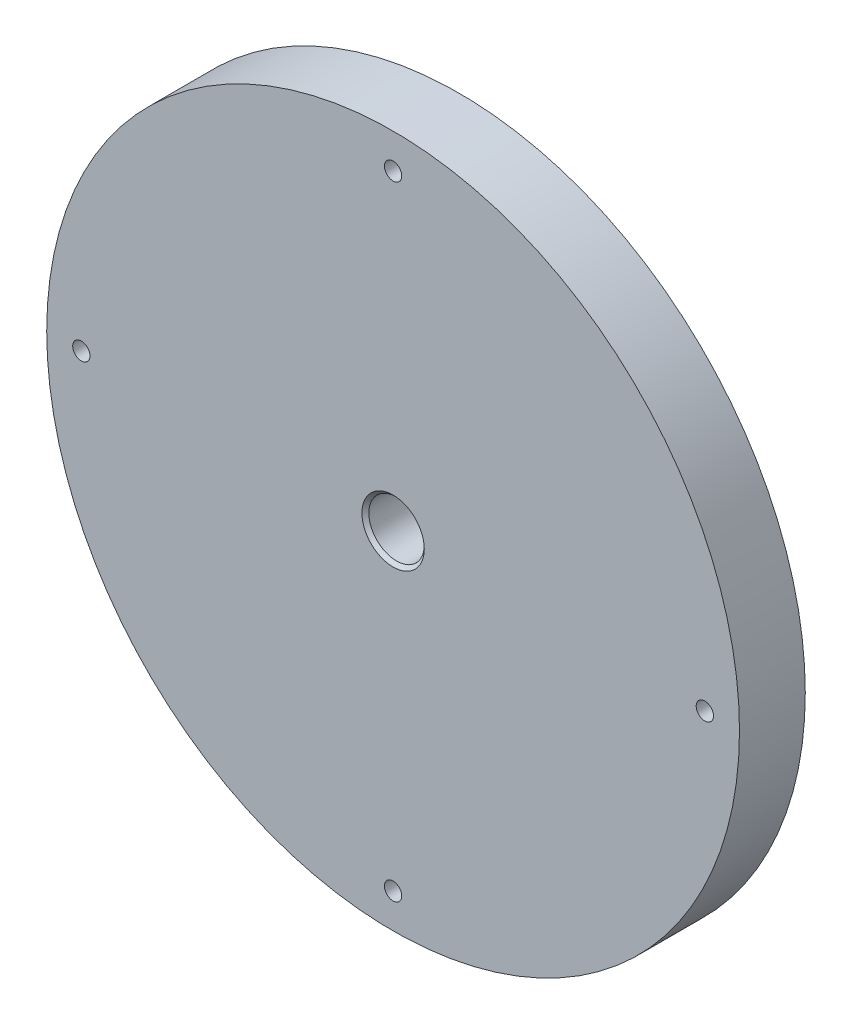
from build123d import *

# Parameters (mm, degrees)
SKETCH_1_R          = 100
EXTRUDE_1_DEPTH     = 19
M6X1_0_1_D          = 5
M6X1_0_1_DEPTH      = 17
M6X1_0_1_TIP        = 1.502151548
SKETCH_2_R          = 8
CUT_EXTRUDE_1_DEPTH = 143.691975948
CHAMFER_1_SIZE      = 1
CHAMFER_2_SIZE      = 1


with BuildPart() as part:
    # ｽｹｯﾁ1 → ﾎﾞｽ - 押し出し1 (new body)
    with BuildSketch(Plane.XY):
        Circle(SKETCH_1_R)
    extrude(amount=EXTRUDE_1_DEPTH)

    # M6x1.0 ねじ穴1
    with Locations(Plane(origin=(0, 90, 19), x_dir=(1, 0, 0), z_dir=(0, 0, 1))):
        with Locations((0, 0), (-90, -90), (0, -180), (90, -90)):
            Hole(M6X1_0_1_D / 2, depth=M6X1_0_1_DEPTH)
            with Locations((0, 0, -(M6X1_0_1_DEPTH + M6X1_0_1_TIP / 2))):  # 118° drill point
                Cone(0, M6X1_0_1_D / 2, M6X1_0_1_TIP, mode=Mode.SUBTRACT)

    # ｽｹｯﾁ2 → ｶｯﾄ - 押し出し1 (cut, through all)
    with BuildSketch(Plane.XY.offset(19)):
        Circle(SKETCH_2_R)
    extrude(amount=-CUT_EXTRUDE_1_DEPTH, mode=Mode.SUBTRACT)

    # 面取り1
    chamfer_1_edges = [part.edges().sort_by_distance(p)[0] for p in [
        (-8, 0, 19),
    ]]
    chamfer(chamfer_1_edges, length=CHAMFER_1_SIZE)

    # 面取り2
    chamfer_2_edges = [part.edges().sort_by_distance(p)[0] for p in [
        (-8, 0, 0),
    ]]
    chamfer(chamfer_2_edges, length=CHAMFER_2_SIZE)


solid = part.part
